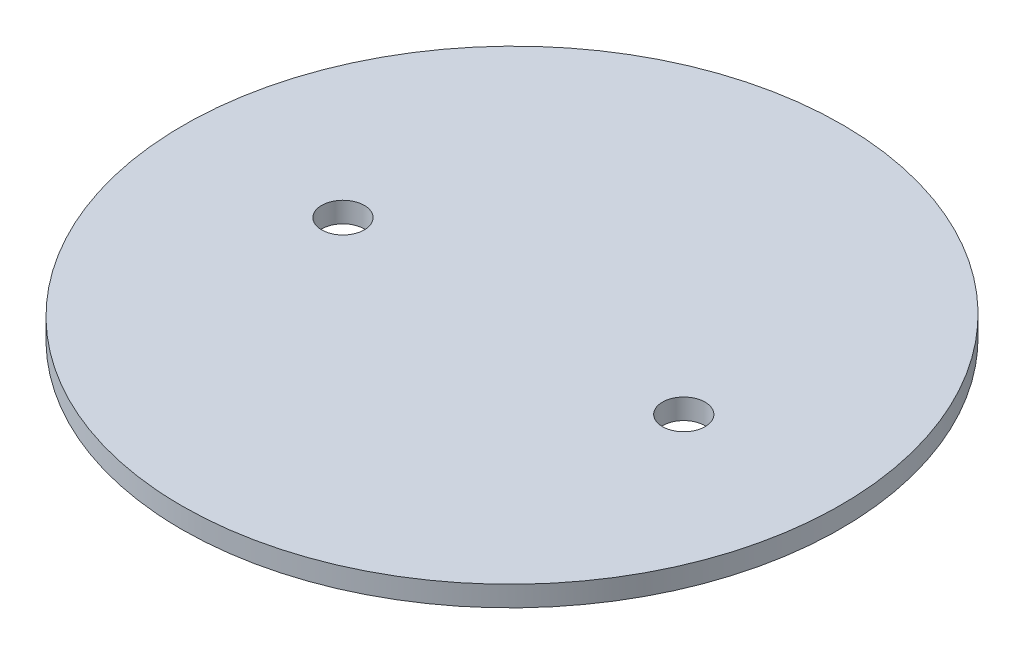
from build123d import *

# Parameters (mm, degrees)
SKETCH1_RX          = 96.9
SKETCH1_RY          = 96.5
SKETCH1_R           = 6.25
BOSS_EXTRUDE1_DEPTH = 3


with BuildPart() as part:
    # Sketch1 → Boss-Extrude1 (new, symmetric)
    with BuildSketch(Plane(origin=(0, 0, 0), x_dir=(1, 0, 0), z_dir=(0, 1, 0))):
        with Locations(Location((0, 0), (0, 0, -90))):
            Ellipse(SKETCH1_RX, SKETCH1_RY)
        with Locations(Location((-49.6, 0, 0), (0, 0, 270))):
            Circle(SKETCH1_R, mode=Mode.SUBTRACT)
        with Locations(Location((50.4, 0, 0), (0, 0, 270))):
            Circle(SKETCH1_R, mode=Mode.SUBTRACT)
    extrude(amount=BOSS_EXTRUDE1_DEPTH, both=True)


solid = part.part
